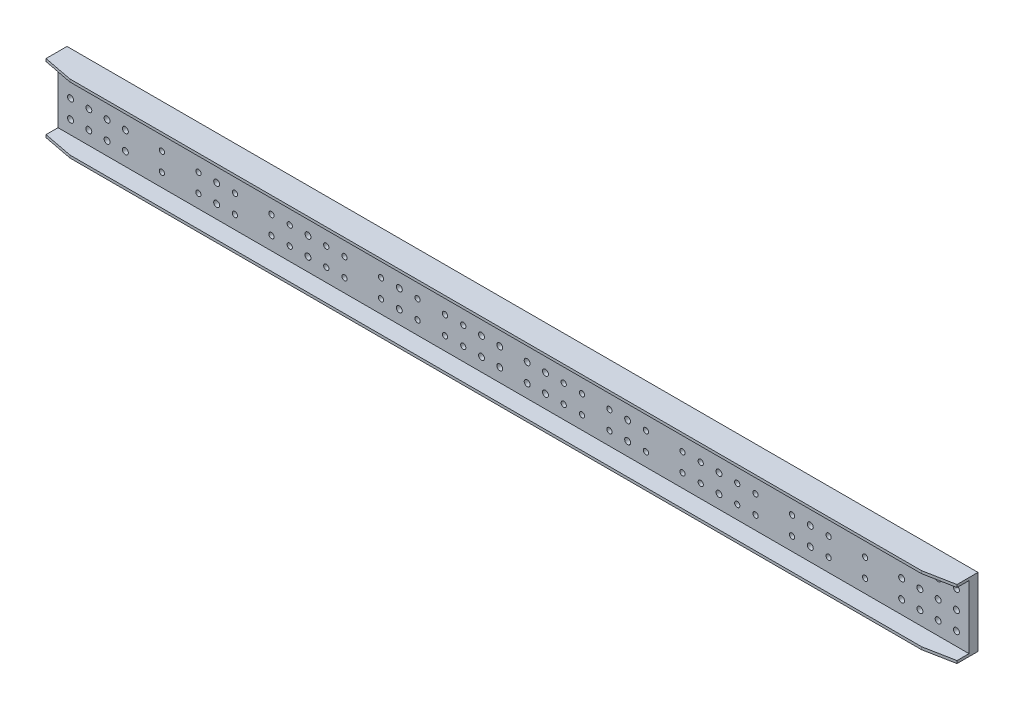
from build123d import *

# Parameters (mm, degrees)
SKETCH_1_W          = 3990
SKETCH_1_H          = 300
SKETCH_1_R          = 13
SKETCH_1_R_2        = 11.5
EXTRUDE_1539_DEPTH  = 39.5
SKETCH_2_W          = 3990
SKETCH_2_H          = 11.5
EXTRUDE_1_DEPTH     = 77.5
SKETCH_3_W          = 70
SKETCH_3_H          = 230
EXTRUDE_2_DEPTH     = 16
SKETCH_4_R          = 13
CUT_EXTRUDE_1_DEPTH = 2003.131676489
CUT_EXTRUDE_2_DEPTH = 2021.820130541


with BuildPart() as part:
    # 草图1 → Extrude 1539 (new body)
    with BuildSketch(Plane.XY):
        Rectangle(SKETCH_1_W, SKETCH_1_H)
        with Locations((1940, 80)):
            Circle(SKETCH_1_R, mode=Mode.SUBTRACT)
        with Locations((1860, 80)):
            Circle(SKETCH_1_R, mode=Mode.SUBTRACT)
        with Locations((1780, 80)):
            Circle(SKETCH_1_R, mode=Mode.SUBTRACT)
        with Locations((1700, 80)):
            Circle(SKETCH_1_R, mode=Mode.SUBTRACT)
        with Locations((1540, 80)):
            Circle(SKETCH_1_R_2, mode=Mode.SUBTRACT)
        with Locations((1380, 80)):
            Circle(SKETCH_1_R_2, mode=Mode.SUBTRACT)
        with Locations((1220, 80)):
            Circle(SKETCH_1_R_2, mode=Mode.SUBTRACT)
        with Locations((1060, 80)):
            Circle(SKETCH_1_R_2, mode=Mode.SUBTRACT)
        with Locations((980, 80)):
            Circle(SKETCH_1_R_2, mode=Mode.SUBTRACT)
        with Locations((820, 80)):
            Circle(SKETCH_1_R_2, mode=Mode.SUBTRACT)
        with Locations((740, 80)):
            Circle(SKETCH_1_R_2, mode=Mode.SUBTRACT)
        with Locations((580, 80)):
            Circle(SKETCH_1_R_2, mode=Mode.SUBTRACT)
        with Locations((980, 0)):
            Circle(SKETCH_1_R_2, mode=Mode.SUBTRACT)
        with Locations((1060, 0)):
            Circle(SKETCH_1_R_2, mode=Mode.SUBTRACT)
        with Locations((820, 0)):
            Circle(SKETCH_1_R_2, mode=Mode.SUBTRACT)
        with Locations((740, 0)):
            Circle(SKETCH_1_R_2, mode=Mode.SUBTRACT)
        with Locations((580, 0)):
            Circle(SKETCH_1_R_2, mode=Mode.SUBTRACT)
        with Locations((1220, 0)):
            Circle(SKETCH_1_R_2, mode=Mode.SUBTRACT)
        with Locations((1380, 0)):
            Circle(SKETCH_1_R_2, mode=Mode.SUBTRACT)
        with Locations((1540, 0)):
            Circle(SKETCH_1_R_2, mode=Mode.SUBTRACT)
        with Locations((1700, 0)):
            Circle(SKETCH_1_R, mode=Mode.SUBTRACT)
        with Locations((1780, 0)):
            Circle(SKETCH_1_R, mode=Mode.SUBTRACT)
        with Locations((1860, 0)):
            Circle(SKETCH_1_R, mode=Mode.SUBTRACT)
        with Locations((1940, 0)):
            Circle(SKETCH_1_R, mode=Mode.SUBTRACT)
        with Locations((420, 80)):
            Circle(SKETCH_1_R_2, mode=Mode.SUBTRACT)
        with Locations((420, 0)):
            Circle(SKETCH_1_R_2, mode=Mode.SUBTRACT)
        with Locations((300, 0)):
            Circle(SKETCH_1_R_2, mode=Mode.SUBTRACT)
        with Locations((300, 80)):
            Circle(SKETCH_1_R_2, mode=Mode.SUBTRACT)
        with Locations((220, 80)):
            Circle(SKETCH_1_R_2, mode=Mode.SUBTRACT)
        with Locations((220, 0)):
            Circle(SKETCH_1_R_2, mode=Mode.SUBTRACT)
        with Locations((140, 0)):
            Circle(SKETCH_1_R, mode=Mode.SUBTRACT)
        with Locations((140, 80)):
            Circle(SKETCH_1_R, mode=Mode.SUBTRACT)
        with Locations((60, 80)):
            Circle(SKETCH_1_R, mode=Mode.SUBTRACT)
        with Locations((60, 0)):
            Circle(SKETCH_1_R, mode=Mode.SUBTRACT)
        with Locations(Location((1700, -80, 0), (0, 0, 180))):
            Circle(SKETCH_1_R, mode=Mode.SUBTRACT)
        with Locations(Location((1780, -80, 0), (0, 0, 180))):
            Circle(SKETCH_1_R, mode=Mode.SUBTRACT)
        with Locations(Location((1860, -80, 0), (0, 0, 180))):
            Circle(SKETCH_1_R, mode=Mode.SUBTRACT)
        with Locations(Location((1940, -80, 0), (0, 0, 180))):
            Circle(SKETCH_1_R, mode=Mode.SUBTRACT)
        with Locations(Location((580, -80, 0), (0, 0, 180))):
            Circle(SKETCH_1_R_2, mode=Mode.SUBTRACT)
        with Locations(Location((740, -80, 0), (0, 0, 180))):
            Circle(SKETCH_1_R_2, mode=Mode.SUBTRACT)
        with Locations(Location((820, -80, 0), (0, 0, 180))):
            Circle(SKETCH_1_R_2, mode=Mode.SUBTRACT)
        with Locations(Location((980, -80, 0), (0, 0, 180))):
            Circle(SKETCH_1_R_2, mode=Mode.SUBTRACT)
        with Locations(Location((1060, -80, 0), (0, 0, 180))):
            Circle(SKETCH_1_R_2, mode=Mode.SUBTRACT)
        with Locations(Location((1220, -80, 0), (0, 0, 180))):
            Circle(SKETCH_1_R_2, mode=Mode.SUBTRACT)
        with Locations(Location((1380, -80, 0), (0, 0, 180))):
            Circle(SKETCH_1_R_2, mode=Mode.SUBTRACT)
        with Locations(Location((1540, -80, 0), (0, 0, 180))):
            Circle(SKETCH_1_R_2, mode=Mode.SUBTRACT)
        with Locations(Location((220, -80, 0), (0, 0, 180))):
            Circle(SKETCH_1_R_2, mode=Mode.SUBTRACT)
        with Locations(Location((300, -80, 0), (0, 0, 180))):
            Circle(SKETCH_1_R_2, mode=Mode.SUBTRACT)
        with Locations(Location((420, -80, 0), (0, 0, 180))):
            Circle(SKETCH_1_R_2, mode=Mode.SUBTRACT)
        with Locations(Location((60, -80, 0), (0, 0, 180))):
            Circle(SKETCH_1_R, mode=Mode.SUBTRACT)
        with Locations(Location((140, -80, 0), (0, 0, 180))):
            Circle(SKETCH_1_R, mode=Mode.SUBTRACT)
        with Locations((-140, -80)):
            Circle(SKETCH_1_R, mode=Mode.SUBTRACT)
        with Locations((-60, -80)):
            Circle(SKETCH_1_R, mode=Mode.SUBTRACT)
        with Locations((-580, -80)):
            Circle(SKETCH_1_R_2, mode=Mode.SUBTRACT)
        with Locations((-420, -80)):
            Circle(SKETCH_1_R_2, mode=Mode.SUBTRACT)
        with Locations((-300, -80)):
            Circle(SKETCH_1_R_2, mode=Mode.SUBTRACT)
        with Locations((-220, -80)):
            Circle(SKETCH_1_R_2, mode=Mode.SUBTRACT)
        with Locations((-1540, -80)):
            Circle(SKETCH_1_R_2, mode=Mode.SUBTRACT)
        with Locations((-1380, -80)):
            Circle(SKETCH_1_R_2, mode=Mode.SUBTRACT)
        with Locations((-1220, -80)):
            Circle(SKETCH_1_R_2, mode=Mode.SUBTRACT)
        with Locations((-1060, -80)):
            Circle(SKETCH_1_R_2, mode=Mode.SUBTRACT)
        with Locations((-980, -80)):
            Circle(SKETCH_1_R_2, mode=Mode.SUBTRACT)
        with Locations((-820, -80)):
            Circle(SKETCH_1_R_2, mode=Mode.SUBTRACT)
        with Locations((-740, -80)):
            Circle(SKETCH_1_R_2, mode=Mode.SUBTRACT)
        with Locations((-1940, -80)):
            Circle(SKETCH_1_R, mode=Mode.SUBTRACT)
        with Locations((-1860, -80)):
            Circle(SKETCH_1_R, mode=Mode.SUBTRACT)
        with Locations((-1780, -80)):
            Circle(SKETCH_1_R, mode=Mode.SUBTRACT)
        with Locations((-1700, -80)):
            Circle(SKETCH_1_R, mode=Mode.SUBTRACT)
        with Locations(Location((-60, 0, 0), (0, 0, 180))):
            Circle(SKETCH_1_R, mode=Mode.SUBTRACT)
        with Locations(Location((-60, 80, 0), (0, 0, 180))):
            Circle(SKETCH_1_R, mode=Mode.SUBTRACT)
        with Locations(Location((-140, 80, 0), (0, 0, 180))):
            Circle(SKETCH_1_R, mode=Mode.SUBTRACT)
        with Locations(Location((-140, 0, 0), (0, 0, 180))):
            Circle(SKETCH_1_R, mode=Mode.SUBTRACT)
        with Locations(Location((-220, 0, 0), (0, 0, 180))):
            Circle(SKETCH_1_R_2, mode=Mode.SUBTRACT)
        with Locations(Location((-220, 80, 0), (0, 0, 180))):
            Circle(SKETCH_1_R_2, mode=Mode.SUBTRACT)
        with Locations(Location((-300, 80, 0), (0, 0, 180))):
            Circle(SKETCH_1_R_2, mode=Mode.SUBTRACT)
        with Locations(Location((-300, 0, 0), (0, 0, 180))):
            Circle(SKETCH_1_R_2, mode=Mode.SUBTRACT)
        with Locations(Location((-420, 0, 0), (0, 0, 180))):
            Circle(SKETCH_1_R_2, mode=Mode.SUBTRACT)
        with Locations(Location((-420, 80, 0), (0, 0, 180))):
            Circle(SKETCH_1_R_2, mode=Mode.SUBTRACT)
        with Locations(Location((-1940, 0, 0), (0, 0, 180))):
            Circle(SKETCH_1_R, mode=Mode.SUBTRACT)
        with Locations(Location((-1860, 0, 0), (0, 0, 180))):
            Circle(SKETCH_1_R, mode=Mode.SUBTRACT)
        with Locations(Location((-1780, 0, 0), (0, 0, 180))):
            Circle(SKETCH_1_R, mode=Mode.SUBTRACT)
        with Locations(Location((-1700, 0, 0), (0, 0, 180))):
            Circle(SKETCH_1_R, mode=Mode.SUBTRACT)
        with Locations(Location((-1540, 0, 0), (0, 0, 180))):
            Circle(SKETCH_1_R_2, mode=Mode.SUBTRACT)
        with Locations(Location((-1380, 0, 0), (0, 0, 180))):
            Circle(SKETCH_1_R_2, mode=Mode.SUBTRACT)
        with Locations(Location((-1220, 0, 0), (0, 0, 180))):
            Circle(SKETCH_1_R_2, mode=Mode.SUBTRACT)
        with Locations(Location((-580, 0, 0), (0, 0, 180))):
            Circle(SKETCH_1_R_2, mode=Mode.SUBTRACT)
        with Locations(Location((-740, 0, 0), (0, 0, 180))):
            Circle(SKETCH_1_R_2, mode=Mode.SUBTRACT)
        with Locations(Location((-820, 0, 0), (0, 0, 180))):
            Circle(SKETCH_1_R_2, mode=Mode.SUBTRACT)
        with Locations(Location((-1060, 0, 0), (0, 0, 180))):
            Circle(SKETCH_1_R_2, mode=Mode.SUBTRACT)
        with Locations(Location((-980, 0, 0), (0, 0, 180))):
            Circle(SKETCH_1_R_2, mode=Mode.SUBTRACT)
        with Locations(Location((-580, 80, 0), (0, 0, 180))):
            Circle(SKETCH_1_R_2, mode=Mode.SUBTRACT)
        with Locations(Location((-740, 80, 0), (0, 0, 180))):
            Circle(SKETCH_1_R_2, mode=Mode.SUBTRACT)
        with Locations(Location((-820, 80, 0), (0, 0, 180))):
            Circle(SKETCH_1_R_2, mode=Mode.SUBTRACT)
        with Locations(Location((-980, 80, 0), (0, 0, 180))):
            Circle(SKETCH_1_R_2, mode=Mode.SUBTRACT)
        with Locations(Location((-1060, 80, 0), (0, 0, 180))):
            Circle(SKETCH_1_R_2, mode=Mode.SUBTRACT)
        with Locations(Location((-1220, 80, 0), (0, 0, 180))):
            Circle(SKETCH_1_R_2, mode=Mode.SUBTRACT)
        with Locations(Location((-1380, 80, 0), (0, 0, 180))):
            Circle(SKETCH_1_R_2, mode=Mode.SUBTRACT)
        with Locations(Location((-1540, 80, 0), (0, 0, 180))):
            Circle(SKETCH_1_R_2, mode=Mode.SUBTRACT)
        with Locations(Location((-1700, 80, 0), (0, 0, 180))):
            Circle(SKETCH_1_R, mode=Mode.SUBTRACT)
        with Locations(Location((-1780, 80, 0), (0, 0, 180))):
            Circle(SKETCH_1_R, mode=Mode.SUBTRACT)
        with Locations(Location((-1860, 80, 0), (0, 0, 180))):
            Circle(SKETCH_1_R, mode=Mode.SUBTRACT)
        with Locations(Location((-1940, 80, 0), (0, 0, 180))):
            Circle(SKETCH_1_R, mode=Mode.SUBTRACT)
    extrude(amount=EXTRUDE_1539_DEPTH)

    # 草图2 → 凸台-拉伸1 (add)
    with BuildSketch(Plane.XY.offset(39.5)):
        with Locations((0, 144.25)):
            Rectangle(SKETCH_2_W, SKETCH_2_H)
        with Locations((0, -144.25)):
            Rectangle(SKETCH_2_W, SKETCH_2_H)
    extrude(amount=EXTRUDE_1_DEPTH)

    # 草图3 → 凸台-拉伸2 (add)
    with BuildSketch(Plane(origin=(0, 0, 0), x_dir=(-1, 0, 0), z_dir=(0, 0, -1))):
        with Locations((1300, 0)):
            Rectangle(SKETCH_3_W, SKETCH_3_H)
        with Locations((900, 0)):
            Rectangle(SKETCH_3_W, SKETCH_3_H)
        with Locations((-1300, 0)):
            Rectangle(SKETCH_3_W, SKETCH_3_H)
        with Locations((500, 0)):
            Rectangle(SKETCH_3_W, SKETCH_3_H)
        with Locations((-900, 0)):
            Rectangle(SKETCH_3_W, SKETCH_3_H)
        with Locations((-500, 0)):
            Rectangle(SKETCH_3_W, SKETCH_3_H)
    extrude(amount=EXTRUDE_2_DEPTH)

    # 草图4 → 切除-拉伸1 (cut, through all)
    with BuildSketch(Plane.XY.offset(39.5)):
        with Locations((1300, 80)):
            Circle(SKETCH_4_R)
        with Locations((900, 80)):
            Circle(SKETCH_4_R)
        with Locations((900, 0)):
            Circle(SKETCH_4_R)
        with Locations((1300, 0)):
            Circle(SKETCH_4_R)
        with Locations(Location((900, -80, 0), (0, 0, 180))):
            Circle(SKETCH_4_R)
        with Locations(Location((1300, -80, 0), (0, 0, 180))):
            Circle(SKETCH_4_R)
        with Locations((500, 80)):
            Circle(SKETCH_4_R)
        with Locations((500, 0)):
            Circle(SKETCH_4_R)
        with Locations(Location((500, -80, 0), (0, 0, 180))):
            Circle(SKETCH_4_R)
        with Locations((-500, -80)):
            Circle(SKETCH_4_R)
        with Locations(Location((-500, 0, 0), (0, 0, 180))):
            Circle(SKETCH_4_R)
        with Locations(Location((-500, 80, 0), (0, 0, 180))):
            Circle(SKETCH_4_R)
        with Locations((-1300, -80)):
            Circle(SKETCH_4_R)
        with Locations((-900, -80)):
            Circle(SKETCH_4_R)
        with Locations(Location((-1300, 0, 0), (0, 0, 180))):
            Circle(SKETCH_4_R)
        with Locations(Location((-900, 0, 0), (0, 0, 180))):
            Circle(SKETCH_4_R)
        with Locations(Location((-900, 80, 0), (0, 0, 180))):
            Circle(SKETCH_4_R)
        with Locations(Location((-1300, 80, 0), (0, 0, 180))):
            Circle(SKETCH_4_R)
    extrude(amount=-CUT_EXTRUDE_1_DEPTH, mode=Mode.SUBTRACT)

    # 草图5 → 切除-拉伸2 (cut, through all)
    with BuildSketch(Plane(origin=(0, 150, 0), x_dir=(-1, 0, 0), z_dir=(0, 1, 0))):
        Polygon((-1995, 92), (-1995, 117), (-1865, 117), align=None)
        Polygon((1865, 117), (1995, 92), (1995, 117), align=None)
    extrude(amount=-CUT_EXTRUDE_2_DEPTH, mode=Mode.SUBTRACT)


solid = part.part
